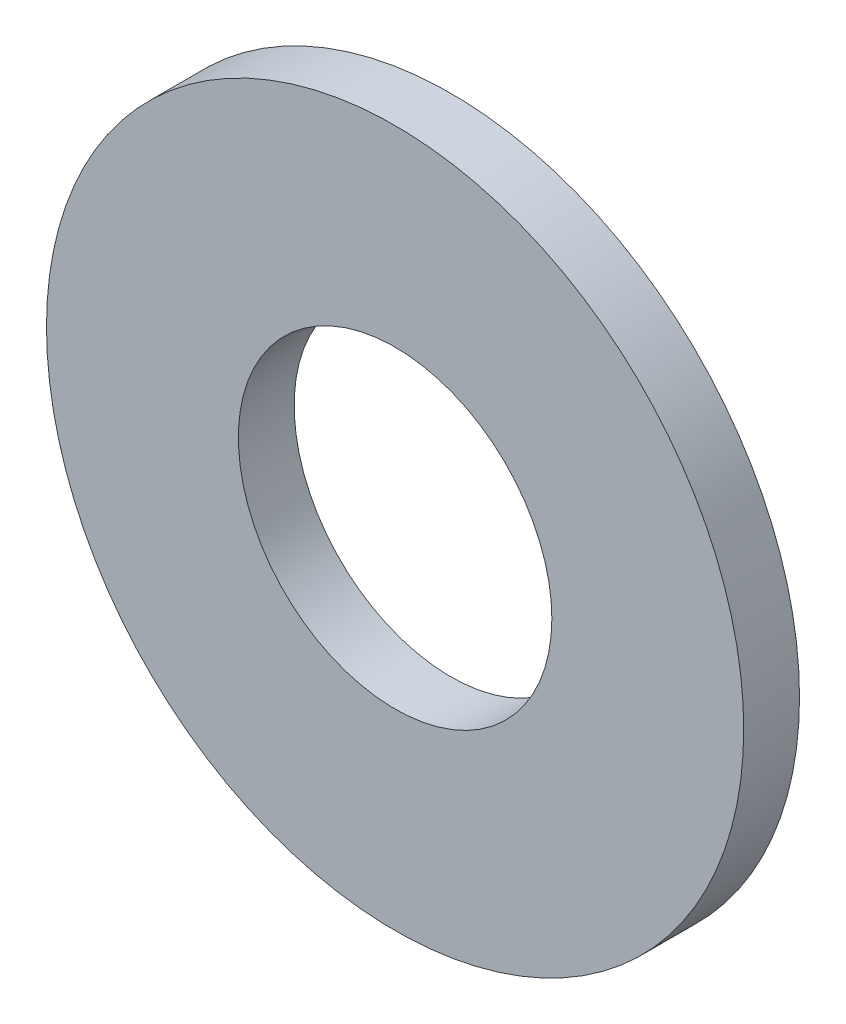
from build123d import *

# Parameters (mm, degrees)
BOSS_EXTRUDE1_DEPTH      = 0.635
BOSS_EXTRUDE1_DEPTH_BACK = 0.635
SKETCH3_R                = 7.9375
SKETCH3_R_2              = 3.5687


with BuildPart() as part:
    # Sketch3 → Boss-Extrude1 (new, two sides: drawn at the far end of the back side and taken through both)
    with BuildSketch(Plane.XY.offset(-BOSS_EXTRUDE1_DEPTH_BACK)):
        Circle(SKETCH3_R)
        Circle(SKETCH3_R_2, mode=Mode.SUBTRACT)
    extrude(amount=BOSS_EXTRUDE1_DEPTH + BOSS_EXTRUDE1_DEPTH_BACK)


solid = part.part
